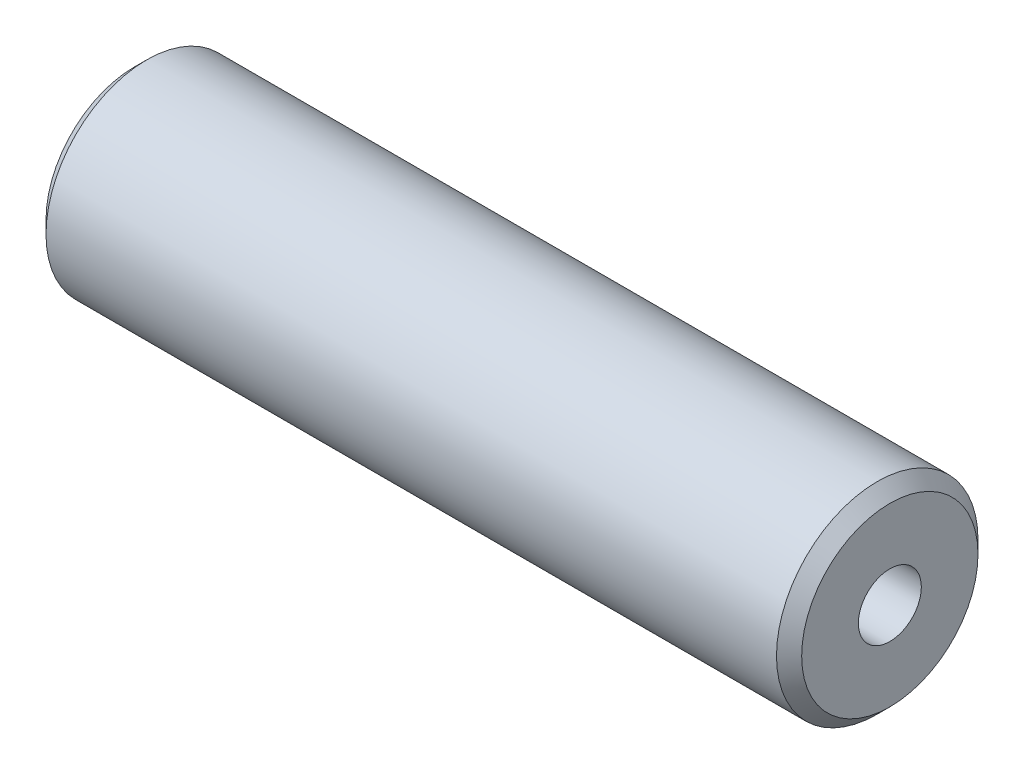
from build123d import *

# Parameters (mm, degrees)
SKETCH1_W          = 30
SKETCH1_H          = 4
TAPPED_HOLE1_D     = 2.5
TAPPED_HOLE1_DEPTH = 8.5
TAPPED_HOLE1_TIP   = 0.751075774
TAPPED_HOLE2_D     = 2.5
TAPPED_HOLE2_DEPTH = 8.5
TAPPED_HOLE2_TIP   = 0.751075774
CHAMFER1_SIZE      = 0.5


with BuildPart() as part:
    # Sketch1 → Revolve1 (revolve)
    with BuildSketch(Plane.XY):
        with Locations((15, 2)):
            Rectangle(SKETCH1_W, SKETCH1_H)
    revolve(axis=Axis((0, 0, 0), (1, 0, 0)))

    # Tapped Hole1
    with Locations(Plane.ZY):
        with Locations((0, 0)):
            Hole(TAPPED_HOLE1_D / 2, depth=TAPPED_HOLE1_DEPTH)
            with Locations((0, 0, -(TAPPED_HOLE1_DEPTH + TAPPED_HOLE1_TIP / 2))):  # 118° drill point
                Cone(0, TAPPED_HOLE1_D / 2, TAPPED_HOLE1_TIP, mode=Mode.SUBTRACT)

    # Tapped Hole2
    with Locations(Plane(origin=(30, 0, 0), x_dir=(0, 0, -1), z_dir=(1, 0, 0))):
        with Locations((0, 0)):
            Hole(TAPPED_HOLE2_D / 2, depth=TAPPED_HOLE2_DEPTH)
            with Locations((0, 0, -(TAPPED_HOLE2_DEPTH + TAPPED_HOLE2_TIP / 2))):  # 118° drill point
                Cone(0, TAPPED_HOLE2_D / 2, TAPPED_HOLE2_TIP, mode=Mode.SUBTRACT)

    # Chamfer1
    chamfer1_edges = [part.edges().sort_by_distance(p)[0] for p in [
        (0, -4, 0),
        (30, -4, 0),
    ]]
    chamfer(chamfer1_edges, length=CHAMFER1_SIZE)


solid = part.part
